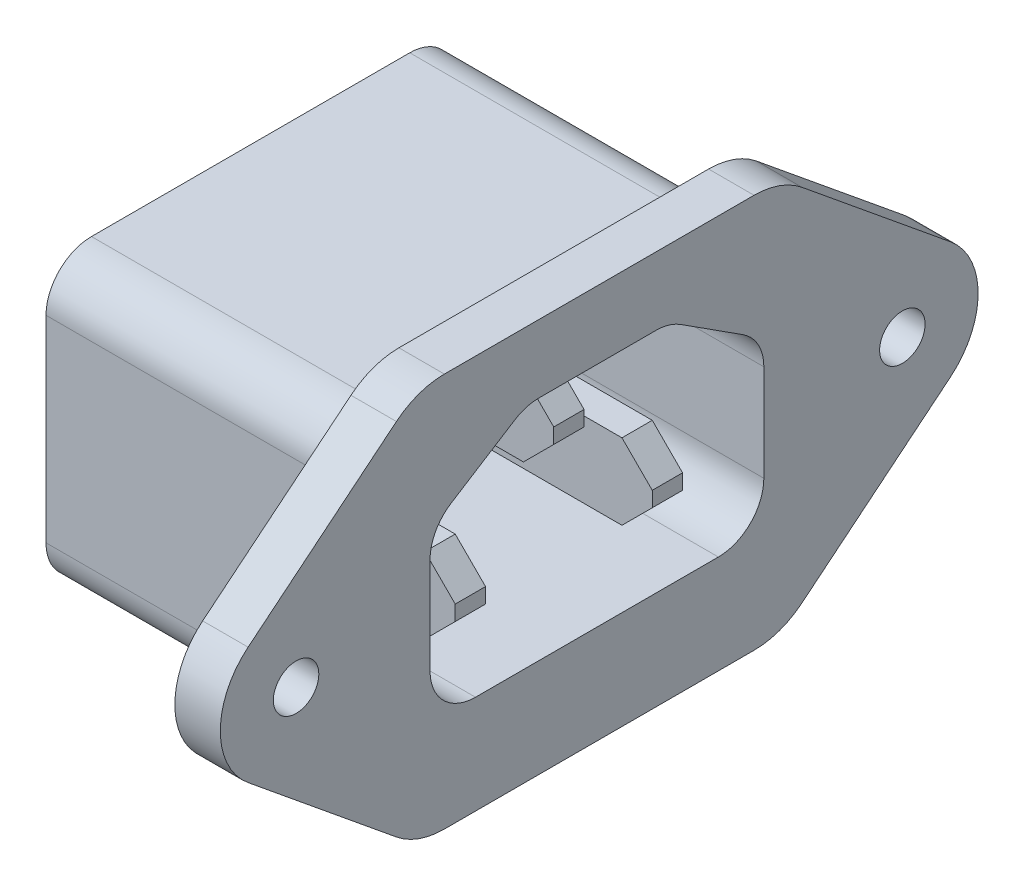
from build123d import *

# Parameters (mm, degrees)
SKETCH1_R             = 1.5
BOSS_EXTRUDE1_DEPTH   = 3
SKETCH2_W             = 27
SKETCH2_H             = 19
BOSS_EXTRUDE2_DEPTH   = 20
FILLET1_R             = 3
CUT_EXTRUDE1_DEPTH    = 16
SKETCH4_W             = 2
SKETCH4_H             = 5
BOSS_EXTRUDE3_DEPTH   = 14
BOSS_EXTRUDE3_2_DEPTH = 14
BOSS_EXTRUDE3_3_DEPTH = 14
CHAMFER1_SIZE         = 2
CHAMFER2_SIZE         = 2
CHAMFER3_SIZE         = 2


with BuildPart() as part:
    # Sketch1 → Boss-Extrude1 (new body)
    with BuildSketch(Plane(origin=(0, 0, 0), x_dir=(0, 0, -1), z_dir=(1, 0, 0))):
        with BuildLine():
            Line((-23.16499284, 3.870764824), (-13.381046978, 11.870764824))
            ThreePointArc((-13.381046978, 11.870764824), (-11.89625887, 12.709236887), (-10.216054138, 13))
            Line((-10.216054138, 13), (10.216054138, 13))
            ThreePointArc((10.216054138, 13), (11.89625887, 12.709236887), (13.381046978, 11.870764824))
            Line((13.381046978, 11.870764824), (23.16499284, 3.870764824))
            ThreePointArc((23.16499284, 3.870764824), (25, 0), (23.16499284, -3.870764824))
            Line((23.16499284, -3.870764824), (13.381046978, -11.870764824))
            ThreePointArc((13.381046978, -11.870764824), (11.89625887, -12.709236887), (10.216054138, -13))
            Line((10.216054138, -13), (-10.216054138, -13))
            ThreePointArc((-10.216054138, -13), (-11.89625887, -12.709236887), (-13.381046978, -11.870764824))
            Line((-13.381046978, -11.870764824), (-23.16499284, -3.870764824))
            ThreePointArc((-23.16499284, -3.870764824), (-25, 0), (-23.16499284, 3.870764824))
        make_face()
        with Locations((-20, 0)):
            Circle(SKETCH1_R, mode=Mode.SUBTRACT)
        with Locations((20, 0)):
            Circle(SKETCH1_R, mode=Mode.SUBTRACT)
    extrude(amount=BOSS_EXTRUDE1_DEPTH)

    # Sketch2 → Boss-Extrude2 (add)
    with BuildSketch(Plane.ZY):
        Rectangle(SKETCH2_W, SKETCH2_H)
    extrude(amount=BOSS_EXTRUDE2_DEPTH)

    # Fillet1
    fillet1_edges = [part.edges().sort_by_distance(p)[0] for p in [
        (-10, 9.5, -13.5),
        (-10, -9.5, -13.5),
        (-10, -9.5, 13.5),
        (-10, 9.5, 13.5),
    ]]
    fillet(fillet1_edges, radius=FILLET1_R)

    # Sketch3 → Cut-Extrude1 (cut)
    with BuildSketch(Plane(origin=(3, 0, 0), x_dir=(0, 0, -1), z_dir=(1, 0, 0))):
        with BuildLine():
            Line((-3.974251102, 8.514836849), (3.75121773, 8.514836849))
            ThreePointArc((3.75121773, 8.514836849), (4.595308875, 8.393640444), (5.371199479, 8.039843608))
            Line((5.371199479, 8.039843608), (9.48076945, 5.403245378))
            ThreePointArc((9.48076945, 5.403245378), (10.493271817, 4.31699759), (10.8607877, 2.878238619))
            Line((10.8607877, 2.878238619), (10.8607877, -3.491879979))
            ThreePointArc((10.8607877, -3.491879979), (9.982108044, -5.613200323), (7.8607877, -6.491879979))
            Line((7.8607877, -6.491879979), (-8.162890641, -6.491879979))
            ThreePointArc((-8.162890641, -6.491879979), (-10.284210984, -5.613200323), (-11.162890641, -3.491879979))
            Line((-11.162890641, -3.491879979), (-11.162890641, 2.865611104))
            ThreePointArc((-11.162890641, 2.865611104), (-10.790706161, 4.312879425), (-9.766500246, 5.401047207))
            Line((-9.766500246, 5.401047207), (-5.577860708, 8.050272952))
            ThreePointArc((-5.577860708, 8.050272952), (-4.809024032, 8.396356267), (-3.974251102, 8.514836849))
        make_face()
    extrude(amount=-CUT_EXTRUDE1_DEPTH, mode=Mode.SUBTRACT)


with BuildPart() as body_2:
    # Sketch4 → Boss-Extrude3 (new body)
    with BuildSketch(Plane(origin=(-13, 0, 0), x_dir=(0, 0, -1), z_dir=(1, 0, 0))):
        with Locations((0, 3.869772999)):
            Rectangle(SKETCH4_W, SKETCH4_H)
    extrude(amount=BOSS_EXTRUDE3_DEPTH)

    # Chamfer1
    chamfer1_edges = [body_2.edges().sort_by_distance(p)[0] for p in [
        (1, 6.369772999, 0),
        (1, 1.369772999, 0),
    ]]
    chamfer(chamfer1_edges, length=CHAMFER1_SIZE)


with BuildPart() as body_3:
    # Sketch4 → Boss-Extrude3 2 (new body)
    with BuildSketch(Plane(origin=(-13, 0, 0), x_dir=(0, 0, -1), z_dir=(1, 0, 0))):
        with Locations((-6.5, -3)):
            Rectangle(SKETCH4_W, SKETCH4_H)
    extrude(amount=BOSS_EXTRUDE3_2_DEPTH)

    # Chamfer2
    chamfer2_edges = [body_3.edges().sort_by_distance(p)[0] for p in [
        (1, -0.5, 6.5),
        (1, -5.5, 6.5),
    ]]
    chamfer(chamfer2_edges, length=CHAMFER2_SIZE)


with BuildPart() as body_4:
    # Sketch4 → Boss-Extrude3 3 (new body)
    with BuildSketch(Plane(origin=(-13, 0, 0), x_dir=(0, 0, -1), z_dir=(1, 0, 0))):
        with Locations((6.5, -3)):
            Rectangle(SKETCH4_W, SKETCH4_H)
    extrude(amount=BOSS_EXTRUDE3_3_DEPTH)

    # Chamfer3
    chamfer3_edges = [body_4.edges().sort_by_distance(p)[0] for p in [
        (1, -0.5, -6.5),
        (1, -5.5, -6.5),
    ]]
    chamfer(chamfer3_edges, length=CHAMFER3_SIZE)


solid = Compound([part.part, body_2.part, body_3.part, body_4.part])
